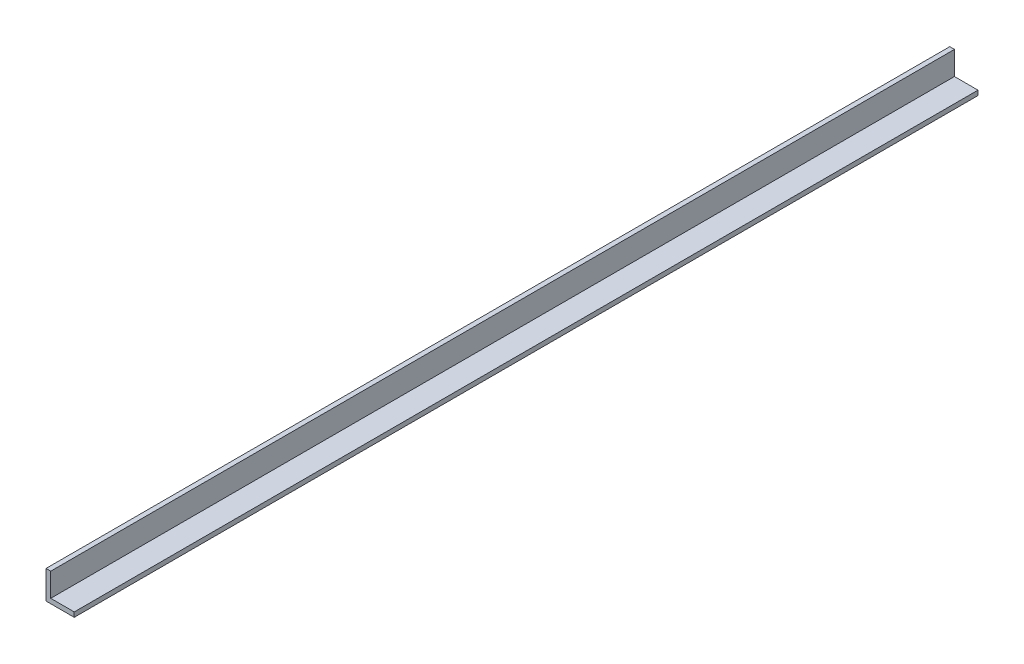
from build123d import *

# Parameters (mm, degrees)
BOSS_EXTRUDE1_DEPTH = 609.6


with BuildPart() as part:
    # Sketch1 → Boss-Extrude1 (new body)
    with BuildSketch(Plane.XY):
        Polygon((0, 0), (19.05, 0), (19.05, 3.175), (3.175, 3.175), (3.175, 19.05), (0, 19.05), align=None)
    extrude(amount=BOSS_EXTRUDE1_DEPTH)


solid = part.part
